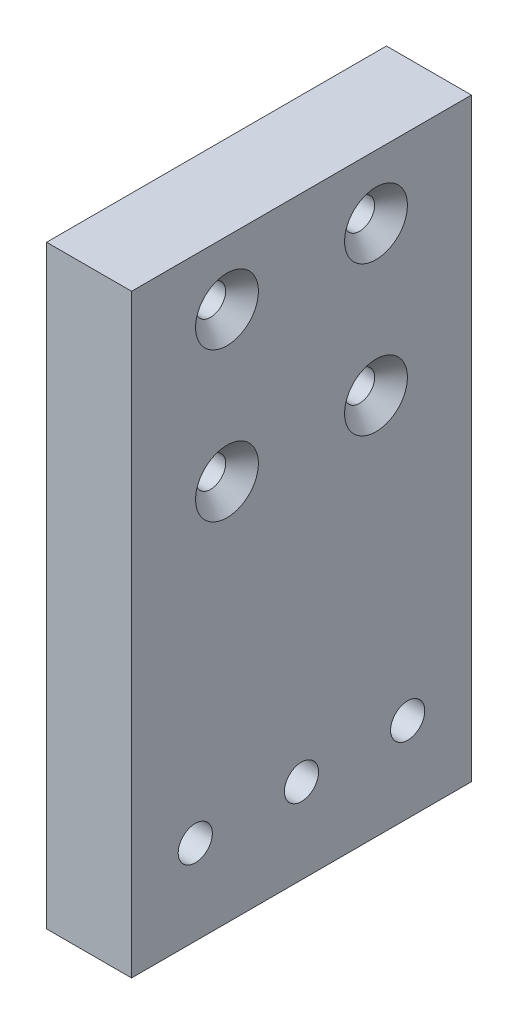
from build123d import *

# Parameters (mm, degrees)
SKETCH1_W                                       = 50.8
SKETCH1_H                                       = 88.9
BOSS_EXTRUDE1_DEPTH                             = 12.7
CSK_FOR_M4_FLAT_HEAD_MACHINE_SCREW1_D           = 4.5
CSK_FOR_M4_FLAT_HEAD_MACHINE_SCREW1_CSINK_D     = 9.4
CSK_FOR_M4_FLAT_HEAD_MACHINE_SCREW1_CSINK_ANGLE = 90
CBORE_FOR_10_SOCKET_HEAD_CAP_SCREW1_D           = 5.1054
CBORE_FOR_10_SOCKET_HEAD_CAP_SCREW1_CBORE_D     = 9.525
CBORE_FOR_10_SOCKET_HEAD_CAP_SCREW1_CBORE_DEPTH = 4.826


with BuildPart() as part:
    # Sketch1 → Boss-Extrude1 (new body)
    with BuildSketch(Plane(origin=(0, 0, 0), x_dir=(0, 0, -1), z_dir=(1, 0, 0))):
        Rectangle(SKETCH1_W, SKETCH1_H)
    extrude(amount=BOSS_EXTRUDE1_DEPTH)

    # CSK for M4 Flat Head Machine Screw1 (through all)
    with Locations(Plane(origin=(12.7, 0, 0), x_dir=(0, 0, -1), z_dir=(1, 0, 0))):
        with Locations((11.136931804, 34.973863607), (-11.136931804, 34.973863607), (-11.136931804, 12.7), (11.136931804, 12.7)):
            CounterSinkHole(CSK_FOR_M4_FLAT_HEAD_MACHINE_SCREW1_D / 2, CSK_FOR_M4_FLAT_HEAD_MACHINE_SCREW1_CSINK_D / 2, counter_sink_angle=CSK_FOR_M4_FLAT_HEAD_MACHINE_SCREW1_CSINK_ANGLE)

    # CBORE for #10 Socket Head Cap Screw1 (through all)
    with Locations(Plane.ZY):
        with Locations((-15.875, -31.75), (0, -31.75), (15.875, -31.75)):
            CounterBoreHole(CBORE_FOR_10_SOCKET_HEAD_CAP_SCREW1_D / 2, CBORE_FOR_10_SOCKET_HEAD_CAP_SCREW1_CBORE_D / 2, CBORE_FOR_10_SOCKET_HEAD_CAP_SCREW1_CBORE_DEPTH)


solid = part.part
